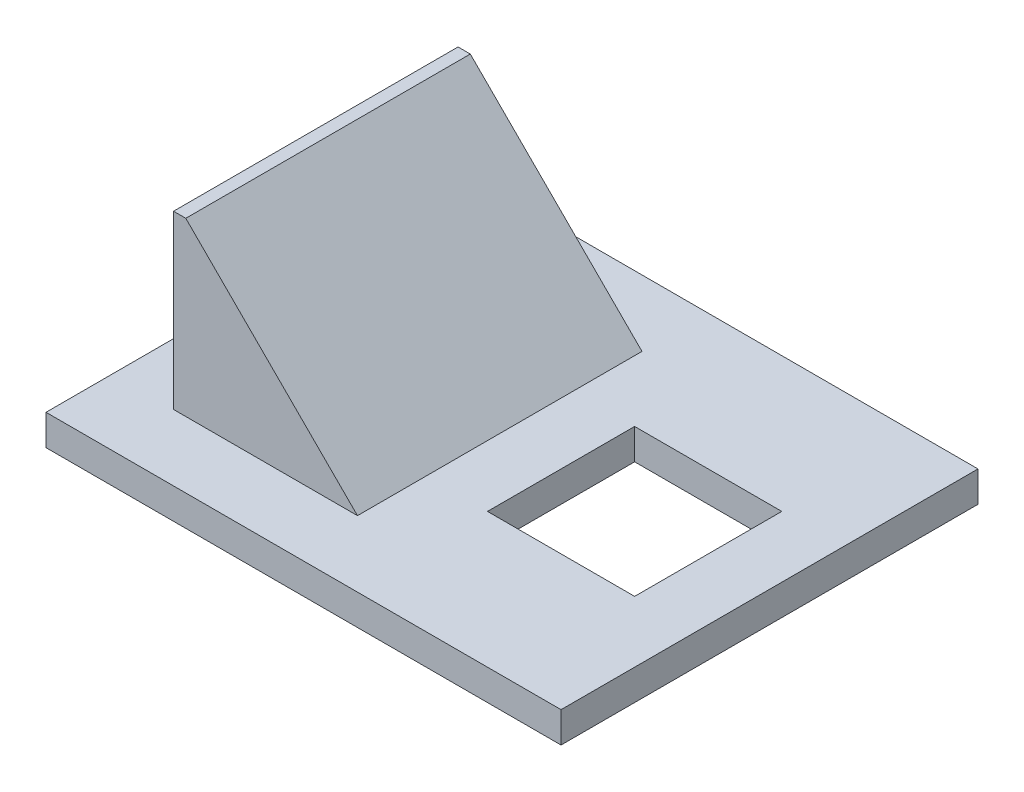
from build123d import *

# Parameters (mm, degrees)
SKETCH_1_W          = 210
SKETCH_1_H          = 170
EXTRUDE_1_DEPTH     = 12.5
SKETCH_2_W          = 60
SKETCH_2_H          = 60
CUT_EXTRUDE_1_DEPTH = 15
SKETCH_3_W          = 70
SKETCH_3_H          = 110
CUT_EXTRUDE_4_DEPTH = 20
EXTRUDE_4_DEPTH     = 5
EXTRUDE_6_DEPTH     = 3
EXTRUDE_7_DEPTH     = 3
EXTRUDE_8_DEPTH     = 3
EXTRUDE_9_DEPTH     = 3


with BuildPart() as part:
    # Эскиз1 → Бобышка-Вытянуть1 (new body)
    with BuildSketch(Plane(origin=(0, 0, 0), x_dir=(1, 0, 0), z_dir=(0, 1, 0))):
        Rectangle(SKETCH_1_W, SKETCH_1_H)
    extrude(amount=EXTRUDE_1_DEPTH)

    # Эскиз2 → Вырез-Вытянуть1 (cut)
    with BuildSketch(Plane(origin=(0, 12.5, 0), x_dir=(1, 0, 0), z_dir=(0, 1, 0))):
        with Locations((50, 0)):
            Rectangle(SKETCH_2_W, SKETCH_2_H)
    extrude(amount=-CUT_EXTRUDE_1_DEPTH, mode=Mode.SUBTRACT)

    # Эскиз3 → Вырез-Вытянуть4 (cut)
    with BuildSketch(Plane(origin=(0, 0, 0), x_dir=(1, 0, 0), z_dir=(0, 1, 0))):
        with Locations((-45, 0)):
            Rectangle(SKETCH_3_W, SKETCH_3_H)
    extrude(amount=CUT_EXTRUDE_4_DEPTH, mode=Mode.SUBTRACT)

    # Sketch 1 2 → Бобышка-Вытянуть4 (add, along a direction that is not the sketch's normal)
    with BuildSketch(Plane(origin=(-10, 12.5, -55), x_dir=(-0.47301616487964127, 0.4730161648796364, 0.7433111162394362), z_dir=(0.7071067811865439, 0.7071067811865512, 0))):
        Polygon((0, 0), (81.764222786, 73.584046315), (147.986485869, 0), (66.222263083, -73.584046315), align=None)
    extrude(amount=EXTRUDE_4_DEPTH, dir=(1, 0, 0))

    # Sketch 3 2 → Бобышка-Вытянуть6 (add)
    with BuildSketch(Plane(origin=(-7.5, 12.5, -55), x_dir=(-0.7194014606174125, 0.6945945136995638, 0), z_dir=(0, 0, 1))):
        Polygon((0, 0), (52.156605895, 50.358102243), (100.778221854, 0), align=None)
    extrude(amount=-EXTRUDE_6_DEPTH)

    # Sketch 4 → Бобышка-Вытянуть7 (add)
    with BuildSketch(Plane(origin=(-7.5, 12.5, 55), x_dir=(-0.7194014606174126, 0.6945945136995636, 0), z_dir=(0, 0, 1))):
        Polygon((0, 0), (100.778221854, 0), (52.156605895, 50.358102243), align=None)
    extrude(amount=EXTRUDE_7_DEPTH)

    # Эскиз7 → Бобышка-Вытянуть8 (add)
    with BuildSketch(Plane(origin=(0, 0, -55), x_dir=(-1, 0, 0), z_dir=(0, 0, -1))):
        Polygon((5, 12.5), (7.5, 12.5), (80, 82.5), (75, 82.5), align=None)
    extrude(amount=EXTRUDE_8_DEPTH)

    # Sketch 5 → Бобышка-Вытянуть9 (add)
    with BuildSketch(Plane(origin=(-5, 12.5, 55), x_dir=(-0.7310552682428726, 0.6823182503600075, 0), z_dir=(0, 0, -1))):
        Polygon((0, 0), (1.827638171, -1.705795626), (102.591422643, 0), (98.936146302, 3.411591252), align=None)
    extrude(amount=-EXTRUDE_9_DEPTH)


solid = part.part
